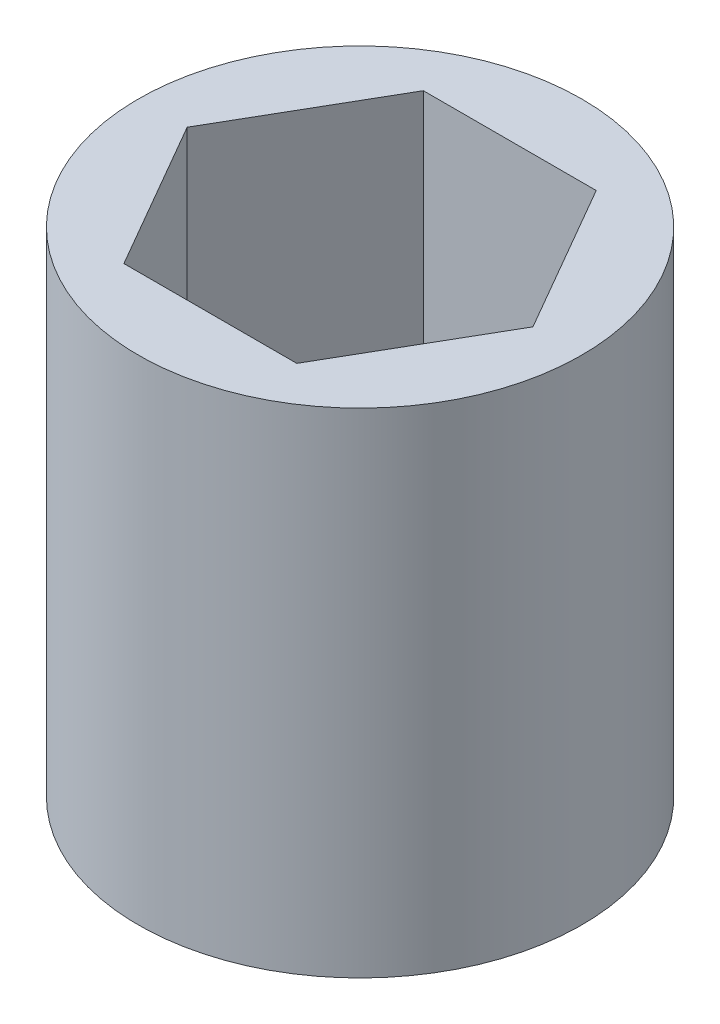
from build123d import *

# Parameters (mm, degrees)
SKETCH1_R           = 10.16
BOSS_EXTRUDE1_DEPTH = 22.606


with BuildPart() as part:
    # Sketch1 → Boss-Extrude1 (new body)
    with BuildSketch(Plane(origin=(0, 0, 0), x_dir=(1, 0, 0), z_dir=(0, 1, 0))):
        with Locations(Location((0, 0, 0), (0, 0, 90))):
            Circle(SKETCH1_R)
        Polygon((7.918936292, 0), (3.959468146, 6.858), (-3.959468146, 6.858), (-7.918936292, 0), (-3.959468146, -6.858), (3.959468146, -6.858), align=None, mode=Mode.SUBTRACT)
    extrude(amount=BOSS_EXTRUDE1_DEPTH)


solid = part.part
